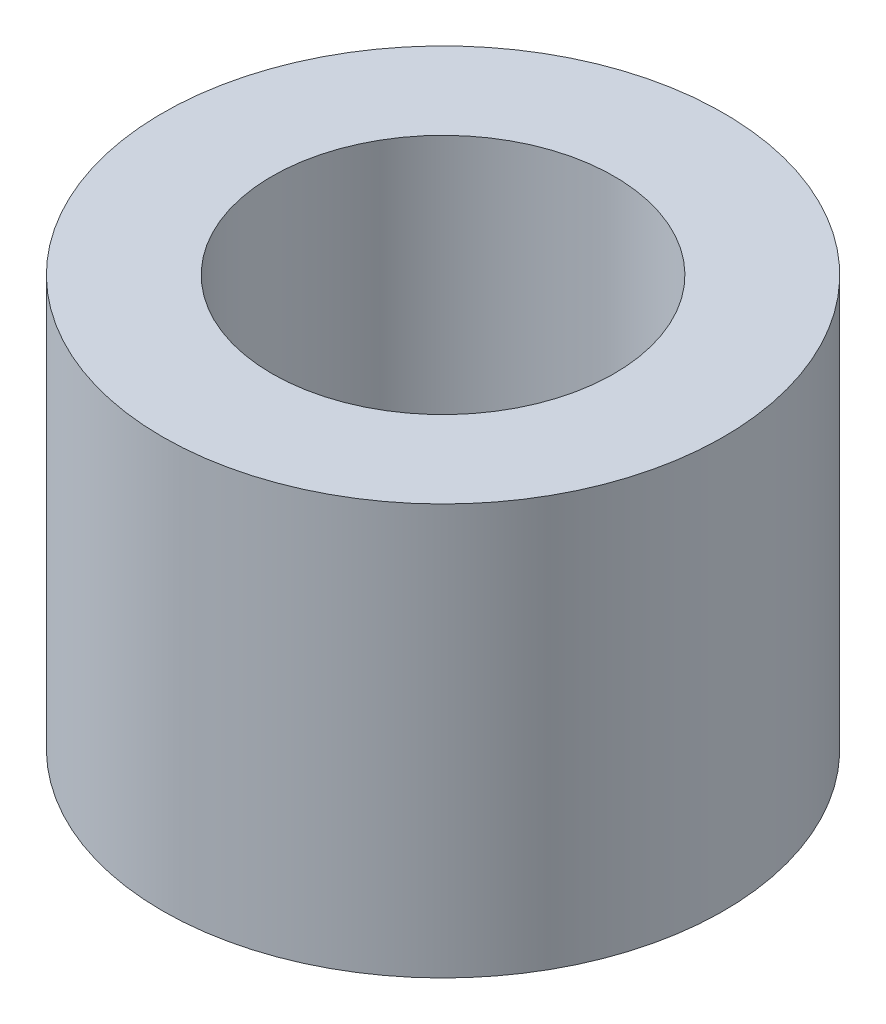
from build123d import *

# Parameters (mm, degrees)
SKETCH1_R           = 15.621
SKETCH1_R_2         = 9.525
BOSS_EXTRUDE1_DEPTH = 22.86


with BuildPart() as part:
    # Sketch1 → Boss-Extrude1 (new body)
    with BuildSketch(Plane(origin=(0, 0, 0), x_dir=(1, 0, 0), z_dir=(0, 1, 0))):
        with Locations(Location((0, 0, 0), (0, 0, 270))):
            Circle(SKETCH1_R)
        with Locations(Location((0, 0, 0), (0, 0, 270))):
            Circle(SKETCH1_R_2, mode=Mode.SUBTRACT)
    extrude(amount=BOSS_EXTRUDE1_DEPTH)


solid = part.part
